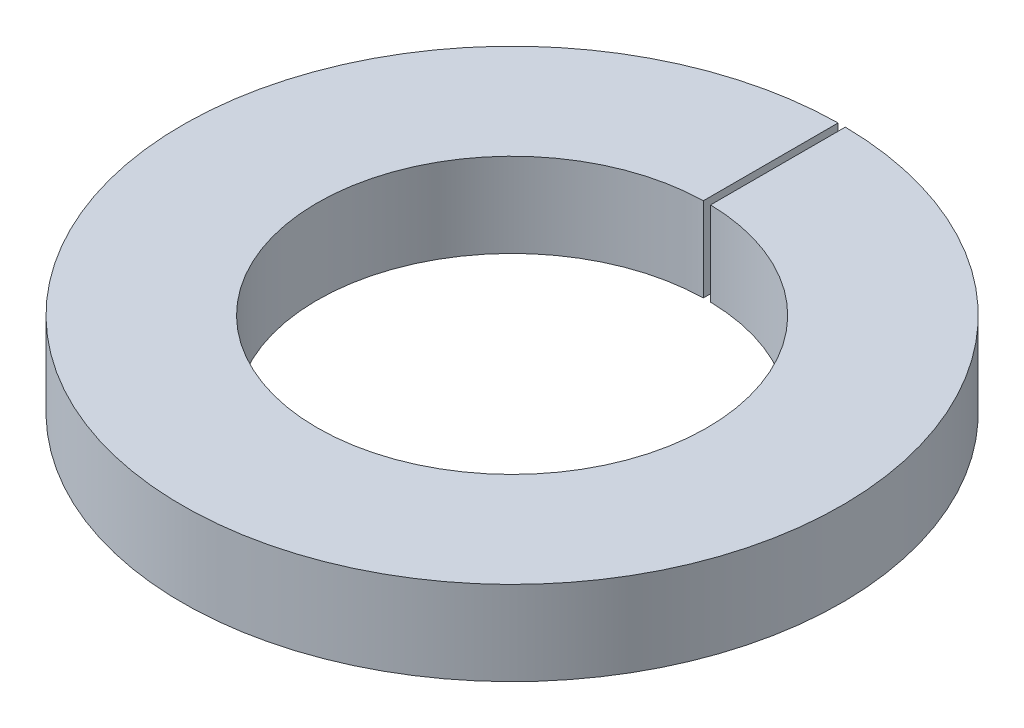
from build123d import *

# Parameters (mm, degrees)
SKETCH_1_R          = 13.7
SKETCH_1_R_2        = 8.1
EXTRUDE_1_DEPTH     = 3.5
SKETCH_2_W          = 0.3
SKETCH_2_H          = 40
CUT_EXTRUDE_1_DEPTH = 20.688321411


with BuildPart() as part:
    # Эскиз1 → Бобышка-Вытянуть1 (new body)
    with BuildSketch(Plane(origin=(0, 0, 0), x_dir=(1, 0, 0), z_dir=(0, 1, 0))):
        with Locations(Location((0, 0, 0), (0, 0, 270))):
            Circle(SKETCH_1_R)
        with Locations(Location((0, 0, 0), (0, 0, 270))):
            Circle(SKETCH_1_R_2, mode=Mode.SUBTRACT)
    extrude(amount=EXTRUDE_1_DEPTH)

    # Эскиз2 → Вырез-Вытянуть1 (cut, through all)
    with BuildSketch(Plane(origin=(0, 3.5, 0), x_dir=(1, 0, 0), z_dir=(0, 1, 0))):
        with Locations((0, 20)):
            Rectangle(SKETCH_2_W, SKETCH_2_H)
    extrude(amount=-CUT_EXTRUDE_1_DEPTH, mode=Mode.SUBTRACT)


solid = part.part
